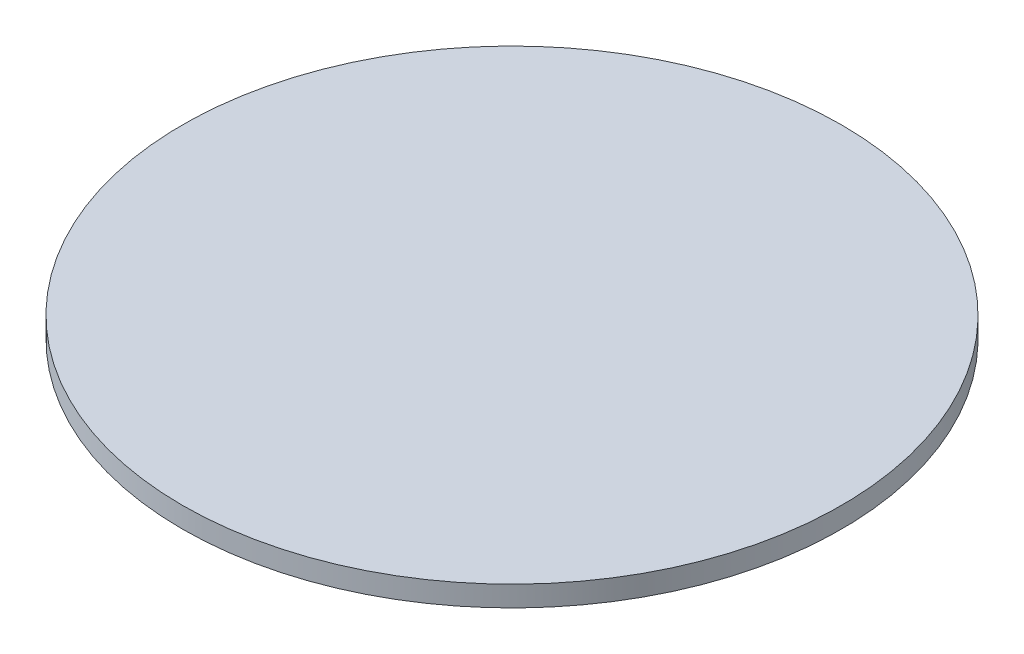
from build123d import *

# Parameters (mm, degrees)
SKETCH1_R           = 130
BOSS_EXTRUDE1_DEPTH = 20
SKETCH2_R           = 160
BOSS_EXTRUDE2_DEPTH = 10


with BuildPart() as part:
    # Sketch1 → Boss-Extrude1 (new body)
    with BuildSketch(Plane(origin=(0, 0, 0), x_dir=(1, 0, 0), z_dir=(0, 1, 0))):
        with Locations(Location((0, 0, 0), (0, 0, 270))):
            Circle(SKETCH1_R)
    extrude(amount=-BOSS_EXTRUDE1_DEPTH)

    # Sketch2 → Boss-Extrude2 (add)
    with BuildSketch(Plane(origin=(0, 0, 0), x_dir=(1, 0, 0), z_dir=(0, 1, 0))):
        with Locations(Location((0, 0, 0), (0, 0, 270))):
            Circle(SKETCH2_R)
    extrude(amount=BOSS_EXTRUDE2_DEPTH)


solid = part.part
